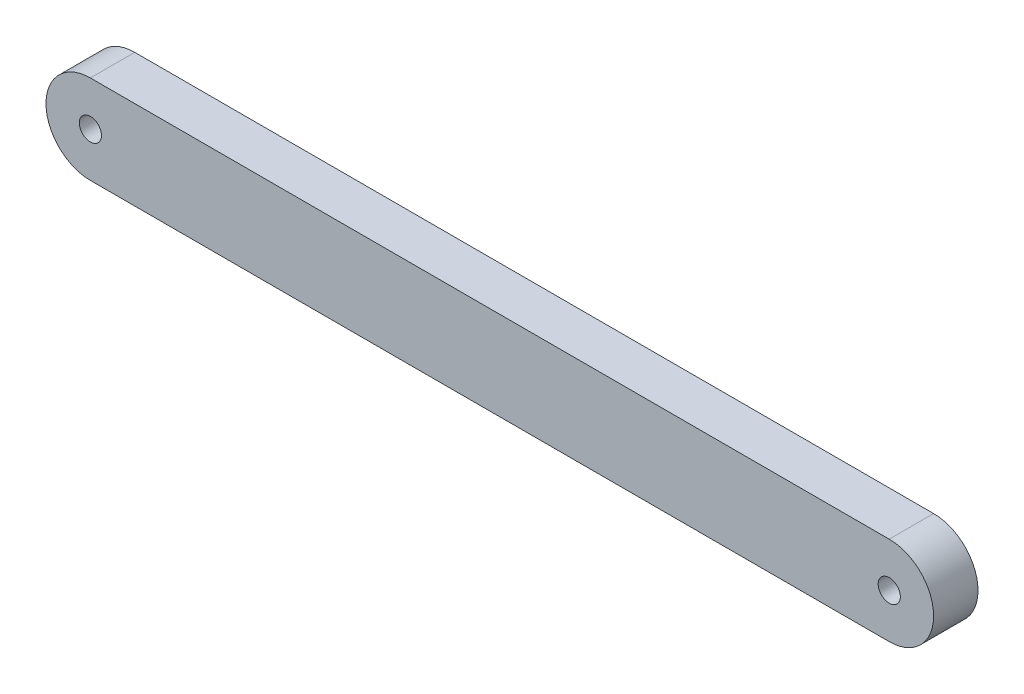
from build123d import *

# Parameters (mm, degrees)
SKETCH1_R           = 2.5
BOSS_EXTRUDE1_DEPTH = 10


with BuildPart() as part:
    # Sketch1 → Boss-Extrude1 (new body)
    with BuildSketch(Plane.XY):
        with BuildLine():
            Line((0, 10), (180, 10))
            ThreePointArc((180, 10), (190, 0), (180, -10))
            Line((180, -10), (0, -10))
            ThreePointArc((0, -10), (-10, 0), (0, 10))
        make_face()
        Circle(SKETCH1_R, mode=Mode.SUBTRACT)
        with Locations((180, 0)):
            Circle(SKETCH1_R, mode=Mode.SUBTRACT)
    extrude(amount=BOSS_EXTRUDE1_DEPTH)


solid = part.part
